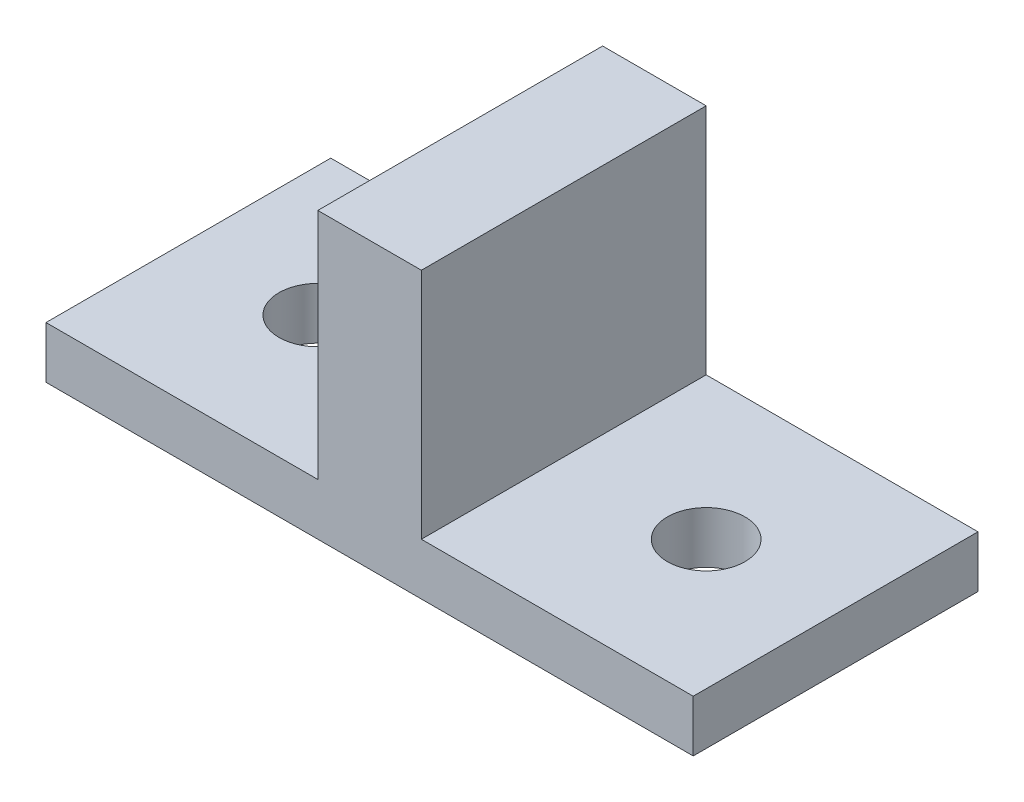
from build123d import *

# Parameters (mm, degrees)
SKETCH1_W           = 125
SKETCH1_H           = 55
BOSS_EXTRUDE1_DEPTH = 10
SKETCH2_R           = 7.5
CUT_EXTRUDE1_DEPTH  = 10
SKETCH3_W           = 20
SKETCH3_H           = 55
BOSS_EXTRUDE2_DEPTH = 45


with BuildPart() as part:
    # Sketch1 → Boss-Extrude1 (new body)
    with BuildSketch(Plane(origin=(0, 0, 0), x_dir=(1, 0, 0), z_dir=(0, 1, 0))):
        Rectangle(SKETCH1_W, SKETCH1_H)
    extrude(amount=BOSS_EXTRUDE1_DEPTH)

    # Sketch2 → Cut-Extrude1 (cut)
    with BuildSketch(Plane(origin=(0, 10, 0), x_dir=(1, 0, 0), z_dir=(0, 1, 0))):
        with Locations(Location((-37.5, 0, 0), (0, 0, 270))):
            Circle(SKETCH2_R)
        with Locations(Location((37.5, 0, 0), (0, 0, 270))):
            Circle(SKETCH2_R)
    extrude(amount=-CUT_EXTRUDE1_DEPTH, mode=Mode.SUBTRACT)

    # Sketch3 → Boss-Extrude2 (add)
    with BuildSketch(Plane(origin=(0, 10, 0), x_dir=(1, 0, 0), z_dir=(0, 1, 0))):
        Rectangle(SKETCH3_W, SKETCH3_H)
    extrude(amount=BOSS_EXTRUDE2_DEPTH)


solid = part.part
